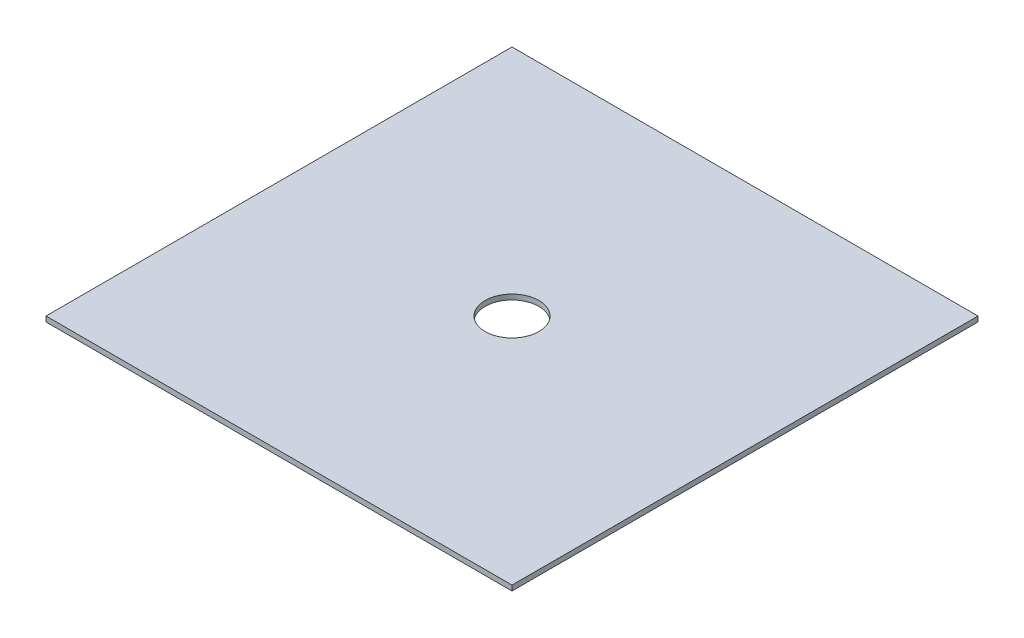
from build123d import *

# Parameters (mm, degrees)
SKETCH1_W           = 571.5
SKETCH1_H           = 571.5
SKETCH1_R           = 33.02
BOSS_EXTRUDE1_DEPTH = 6.35


with BuildPart() as part:
    # Sketch1 → Boss-Extrude1 (new body)
    with BuildSketch(Plane(origin=(0, 0, 0), x_dir=(1, 0, 0), z_dir=(0, 1, 0))):
        Rectangle(SKETCH1_W, SKETCH1_H)
        with Locations(Location((0, 0, 0), (0, 0, 270))):
            Circle(SKETCH1_R, mode=Mode.SUBTRACT)
    extrude(amount=BOSS_EXTRUDE1_DEPTH)


solid = part.part
